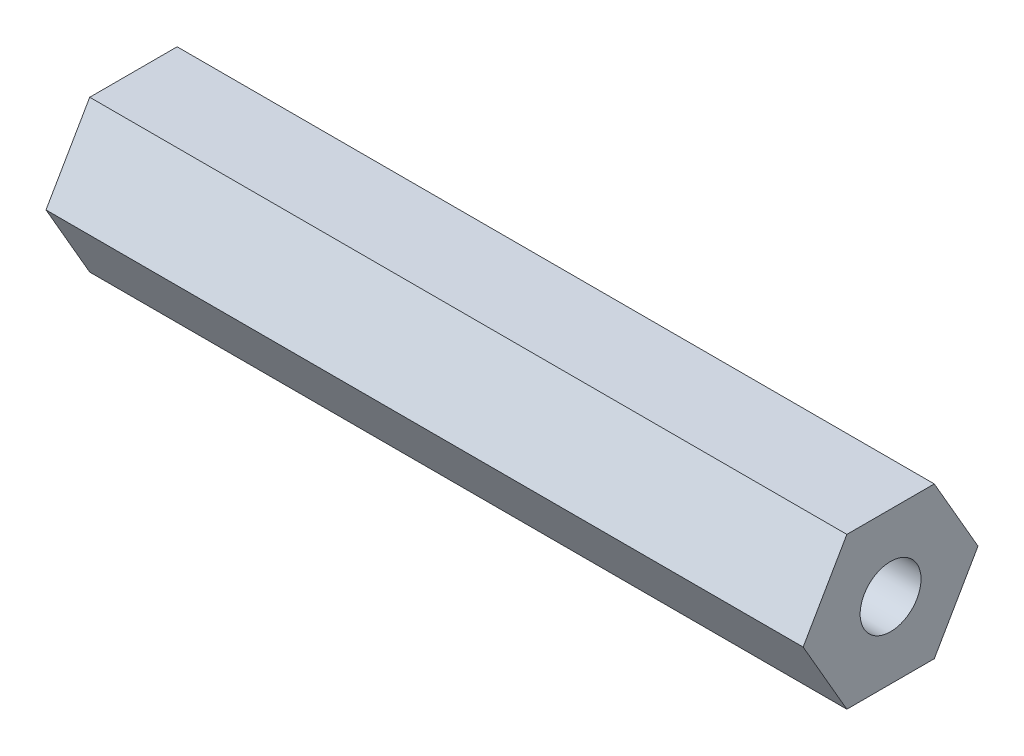
from build123d import *

# Parameters (mm, degrees)
BOSS_EXTRUDE1_DEPTH         = 63.5
F_1_4_20_TAPPED_HOLE1_D     = 5.1054
F_1_4_20_TAPPED_HOLE1_DEPTH = 16.51
F_1_4_20_TAPPED_HOLE1_TIP   = 1.533816902
F_1_4_20_TAPPED_HOLE2_D     = 5.1054
F_1_4_20_TAPPED_HOLE2_DEPTH = 16.51
F_1_4_20_TAPPED_HOLE2_TIP   = 1.533816902


with BuildPart() as part:
    # Sketch1 → Boss-Extrude1 (new body)
    with BuildSketch(Plane(origin=(0, 0, 0), x_dir=(0, 0, -1), z_dir=(1, 0, 0))):
        Polygon((7.332348419, 0), (3.666174209, 6.35), (-3.666174209, 6.35), (-7.332348419, 0), (-3.666174209, -6.35), (3.666174209, -6.35), align=None)
    extrude(amount=BOSS_EXTRUDE1_DEPTH)

    # 1/4-20 Tapped Hole1
    with Locations(Plane(origin=(63.5, 0, 0), x_dir=(0, 0, -1), z_dir=(1, 0, 0))):
        with Locations((0, 0)):
            Hole(F_1_4_20_TAPPED_HOLE1_D / 2, depth=F_1_4_20_TAPPED_HOLE1_DEPTH)
            with Locations((0, 0, -(F_1_4_20_TAPPED_HOLE1_DEPTH + F_1_4_20_TAPPED_HOLE1_TIP / 2))):  # 118° drill point
                Cone(0, F_1_4_20_TAPPED_HOLE1_D / 2, F_1_4_20_TAPPED_HOLE1_TIP, mode=Mode.SUBTRACT)

    # 1/4-20 Tapped Hole2
    with Locations(Plane.ZY):
        with Locations((0, 0)):
            Hole(F_1_4_20_TAPPED_HOLE2_D / 2, depth=F_1_4_20_TAPPED_HOLE2_DEPTH)
            with Locations((0, 0, -(F_1_4_20_TAPPED_HOLE2_DEPTH + F_1_4_20_TAPPED_HOLE2_TIP / 2))):  # 118° drill point
                Cone(0, F_1_4_20_TAPPED_HOLE2_D / 2, F_1_4_20_TAPPED_HOLE2_TIP, mode=Mode.SUBTRACT)


solid = part.part
